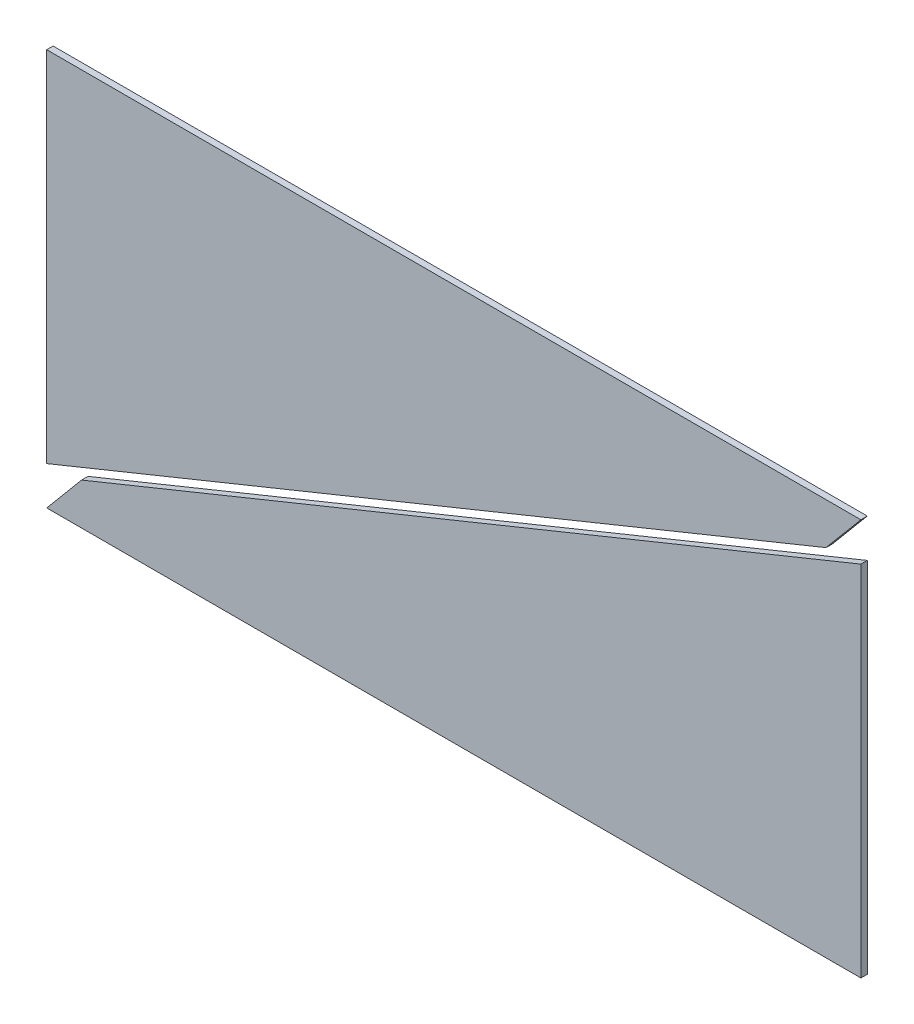
from build123d import *

# Parameters (mm, degrees)
BOSS_EXTRUDE2_DEPTH   = 0.25
BOSS_EXTRUDE2_2_DEPTH = 0.25


with BuildPart() as part:
    # Sketch2 → Boss-Extrude2 (new body)
    with BuildSketch(Plane.XY):
        Polygon((-15.9, -6.25), (-15.9, 7.75), (15.9, 7.75), (14.536441567, 6.124974339), align=None)
    extrude(amount=BOSS_EXTRUDE2_DEPTH)


with BuildPart() as body_2:
    # Sketch2 → Boss-Extrude2 2 (new body)
    with BuildSketch(Plane.XY):
        Polygon((-15.9, -7.75), (15.9, -7.75), (15.9, 6.25), (-14.536441567, -6.124974339), align=None)
    extrude(amount=BOSS_EXTRUDE2_2_DEPTH)


solid = Compound([part.part, body_2.part])
